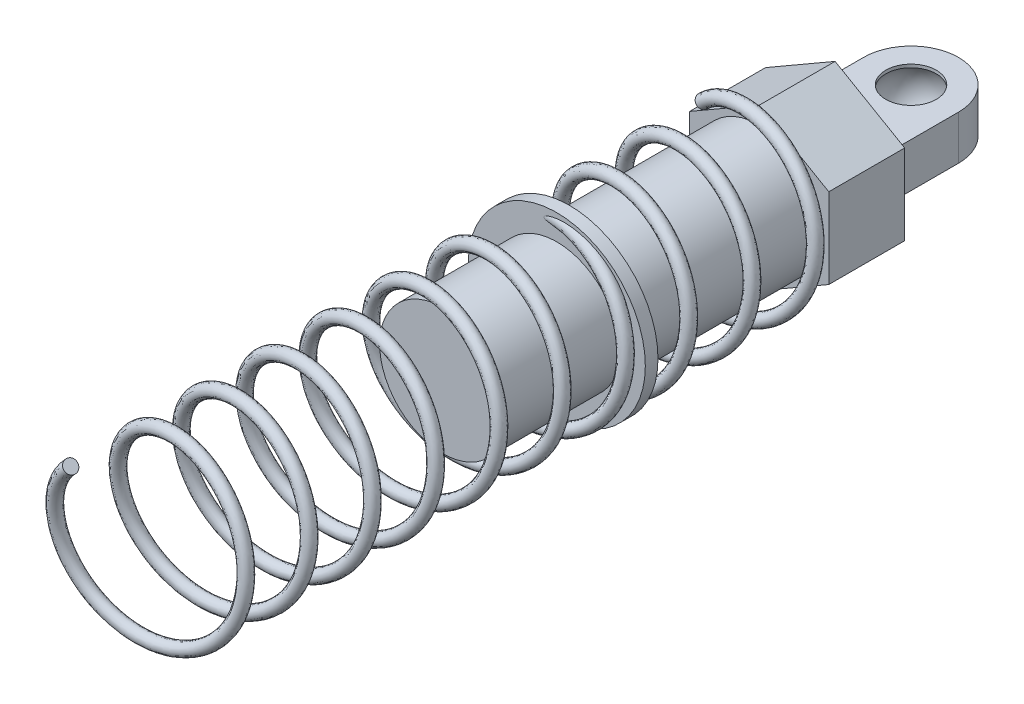
from build123d import *

# Parameters (mm, degrees)
EXTRUDE_1_DEPTH     = 12
SKETCH_2_R          = 10
EXTRUDE_2_DEPTH     = 50
SKETCH_4_R          = 14
EXTRUDE_3_DEPTH     = 2
SKETCH_5_R          = 7.5
EXTRUDE_4_DEPTH     = 3.5
SKETCH_6_R          = 4
CUT_EXTRUDE_1_DEPTH = 7
SWEEP_1_PITCH       = 10
SWEEP_1_HEIGHT      = 100
SWEEP_1_RADIUS      = 12.5
SWEEP_1_START_ANGLE = 135
SWEEP_1_PROFILE_R   = 1


with BuildPart() as part:
    # 草图1 → 凸台-拉伸1 (new body)
    with BuildSketch(Plane.XY):
        Polygon((0, 12.701705922), (-11, 6.350852961), (-11, -6.350852961), (0, -12.701705922), (11, -6.350852961), (11, 6.350852961), align=None)
    extrude(amount=EXTRUDE_1_DEPTH)

    # 草图2 → 凸台-拉伸2 (add)
    with BuildSketch(Plane.XY.offset(12)):
        Circle(SKETCH_2_R)
    extrude(amount=EXTRUDE_2_DEPTH)

    # 草图4 → 凸台-拉伸3 (add)
    with BuildSketch(Plane.XY.offset(42)):
        Circle(SKETCH_4_R)
    extrude(amount=EXTRUDE_3_DEPTH)

    # 草图5 → 凸台-拉伸4 (add, symmetric)
    with BuildSketch(Plane(origin=(0, 0, 0), x_dir=(1, 0, 0), z_dir=(0, 1, 0))):
        with Locations((0, 12)):
            Circle(SKETCH_5_R)
        with BuildLine():
            ThreePointArc((7.5, 12), (0, 4.5), (-7.5, 12))
            Line((-7.5, 12), (-7.5, 0))
            Line((-7.5, 0), (7.5, 0))
            Line((7.5, 0), (7.5, 12))
        make_face()
    extrude(amount=EXTRUDE_4_DEPTH, both=True)

    # 草图6 → 切除-拉伸1 (cut)
    with BuildSketch(Plane(origin=(0, 3.5, 0), x_dir=(1, 0, 0), z_dir=(0, 1, 0))):
        with Locations(Location((0, 12, 0), (0, 0, 270))):
            Circle(SKETCH_6_R)
    extrude(amount=-CUT_EXTRUDE_1_DEPTH, mode=Mode.SUBTRACT)

    # 草图7 → 切除-旋转1 (revolve, cut)
    with BuildSketch(Plane(origin=(0, 0, 0), x_dir=(1, 0, 0), z_dir=(0, 1, 0))):
        with BuildLine():
            Line((0, 17), (0, 7))
            ThreePointArc((0, 7), (5, 12), (0, 17))
        make_face()
    revolve(axis=Axis((0, 0, -15.937456898), (0, 0, 1)), mode=Mode.SUBTRACT)

    # 扫描1: sweep along a helix
    with BuildLine() as sweep_1_path:
        add(Helix(SWEEP_1_PITCH, SWEEP_1_HEIGHT, SWEEP_1_RADIUS, center=(0, 0, 12), direction=(0, 0, 1), lefthand=True, mode=Mode.PRIVATE).rotate(Axis((0, 0, 12), (0, 0, 1)), SWEEP_1_START_ANGLE))
    # 扫描1 profile (on start of the path) → 扫描1 (sweep)
    with BuildSketch(Plane(origin=(-8.838834765, 8.838834765, 12), x_dir=(-0.7071067811864378, 0.7071067811866573, 0), z_dir=(0.7014439490182814, 0.7014439490180637, 0.1263042864339235))):
        Circle(SWEEP_1_PROFILE_R)
    sweep(path=sweep_1_path.line, is_frenet=True)


solid = part.part
